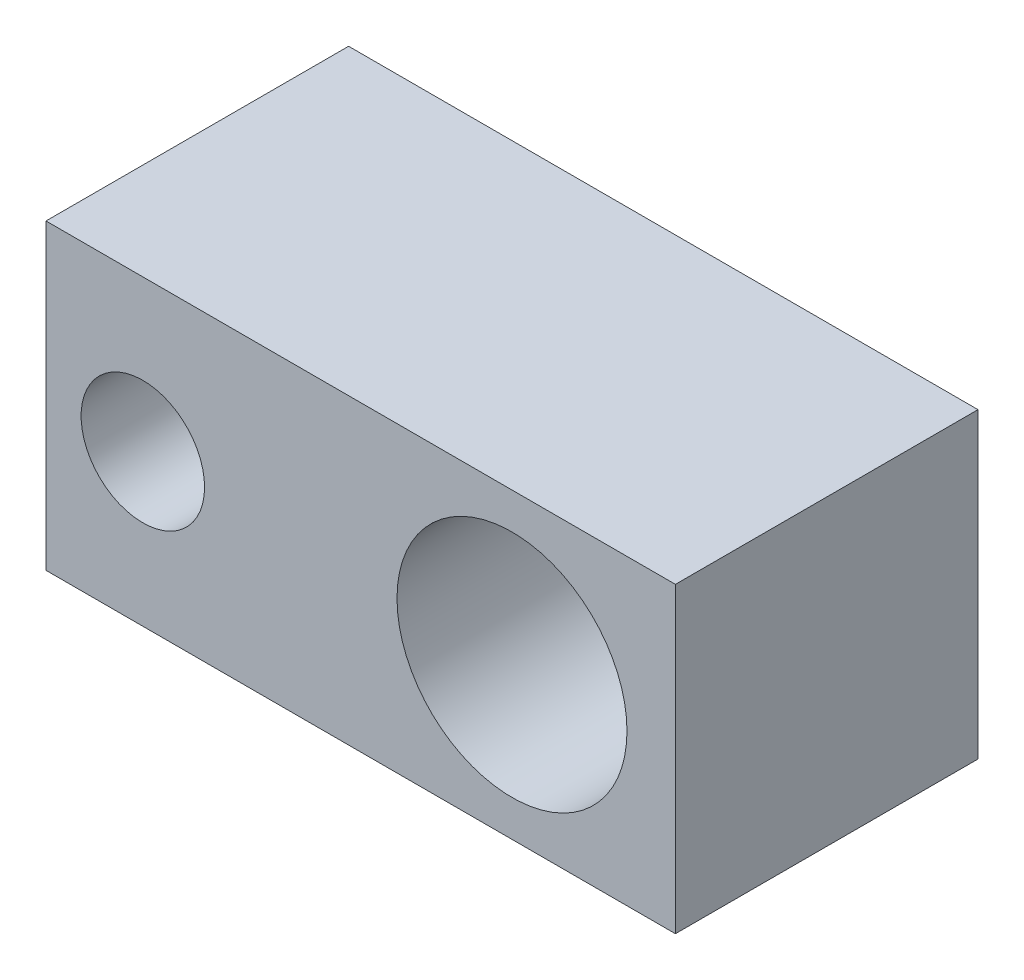
from build123d import *

# Parameters (mm, degrees)
SKETCH1_W           = 52
SKETCH1_H           = 25
SKETCH1_R           = 9.5
SKETCH1_R_2         = 5.1
BOSS_EXTRUDE1_DEPTH = 25


with BuildPart() as part:
    # Sketch1 → Boss-Extrude1 (new body)
    with BuildSketch(Plane.XY):
        Rectangle(SKETCH1_W, SKETCH1_H)
        with Locations((12.5, 0)):
            Circle(SKETCH1_R, mode=Mode.SUBTRACT)
        with Locations((-18, 0)):
            Circle(SKETCH1_R_2, mode=Mode.SUBTRACT)
    extrude(amount=BOSS_EXTRUDE1_DEPTH)


solid = part.part
